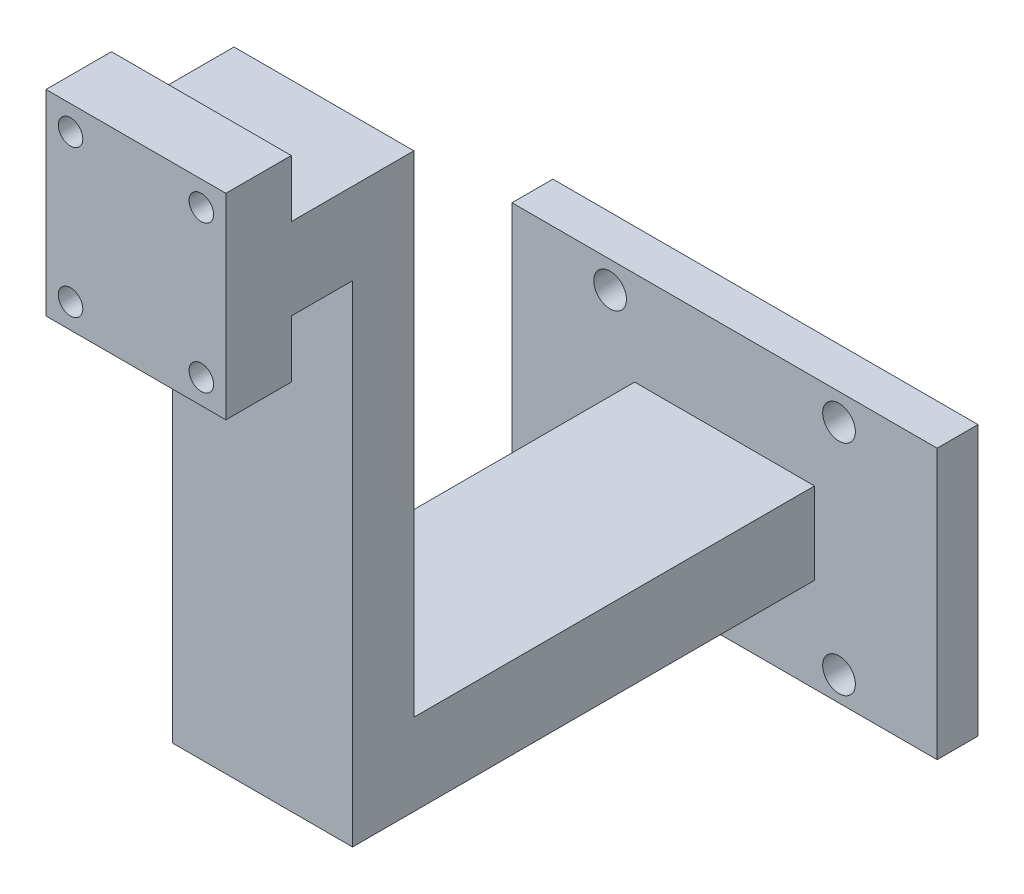
from build123d import *

# Parameters (mm, degrees)
ESQUISSE1_W             = 22
ESQUISSE1_H             = 24
ESQUISSE1_R             = 1.5
BOSS_EXTRU_1_DEPTH      = 8
ESQUISSE1_3_W           = 22
ESQUISSE1_3_H           = 10
BOSS_EXTRU_2_DEPTH      = 15
ESQUISSE2_W             = 22
ESQUISSE2_H             = 7.5
BOSS_EXTRU_3_DEPTH      = 60
ESQUISSE3_W             = 22
ESQUISSE3_H             = 10
BOSS_EXTRU_4_DEPTH      = 54
ESQUISSE4_W             = 52
ESQUISSE4_H             = 33
BOSS_EXTRU_5_DEPTH      = 5
ESQUISSE6_R             = 2
ENL_V_MAT_EXTRU_1_DEPTH = 5


with BuildPart() as part:
    # Esquisse1 → Boss.-Extru.1 (new body)
    with BuildSketch(Plane.XY):
        with Locations((11, 12)):
            Rectangle(ESQUISSE1_W, ESQUISSE1_H)
        with Locations((3, 3)):
            Circle(ESQUISSE1_R, mode=Mode.SUBTRACT)
        with Locations((19, 3)):
            Circle(ESQUISSE1_R, mode=Mode.SUBTRACT)
        with Locations((19, 21)):
            Circle(ESQUISSE1_R, mode=Mode.SUBTRACT)
        with Locations((3, 21)):
            Circle(ESQUISSE1_R, mode=Mode.SUBTRACT)
    extrude(amount=BOSS_EXTRU_1_DEPTH)

    # Esquisse1<3> → Boss.-Extru.2 (add)
    with BuildSketch(Plane.XY):
        with Locations((11, 12)):
            Rectangle(ESQUISSE1_3_W, ESQUISSE1_3_H)
    extrude(amount=-BOSS_EXTRU_2_DEPTH)

    # Esquisse2 → Boss.-Extru.3 (add)
    with BuildSketch(Plane.XZ.offset(-7)):
        with Locations((11, -11.25)):
            Rectangle(ESQUISSE2_W, ESQUISSE2_H)
    extrude(amount=BOSS_EXTRU_3_DEPTH)

    # Esquisse3 → Boss.-Extru.4 (add)
    with BuildSketch(Plane(origin=(0, 0, -15), x_dir=(-1, 0, 0), z_dir=(0, 0, -1))):
        with Locations((-11, -48)):
            Rectangle(ESQUISSE3_W, ESQUISSE3_H)
    extrude(amount=BOSS_EXTRU_4_DEPTH)

    # Esquisse4 → Boss.-Extru.5 (add)
    with BuildSketch(Plane(origin=(0, 0, -69), x_dir=(-1, 0, 0), z_dir=(0, 0, -1))):
        with Locations((-11, -48)):
            Rectangle(ESQUISSE4_W, ESQUISSE4_H)
    extrude(amount=-BOSS_EXTRU_5_DEPTH)

    # Esquisse6 → Enlèv. mat.-Extru.1 (cut)
    with BuildSketch(Plane(origin=(0, 0, -69), x_dir=(-1, 0, 0), z_dir=(0, 0, -1))):
        with Locations((-25, -34.75)):
            Circle(ESQUISSE6_R)
        with Locations((-25, -61.5)):
            Circle(ESQUISSE6_R)
        with Locations((3, -34.75)):
            Circle(ESQUISSE6_R)
        with Locations((3, -61.5)):
            Circle(ESQUISSE6_R)
    extrude(amount=-ENL_V_MAT_EXTRU_1_DEPTH, mode=Mode.SUBTRACT)


solid = part.part
